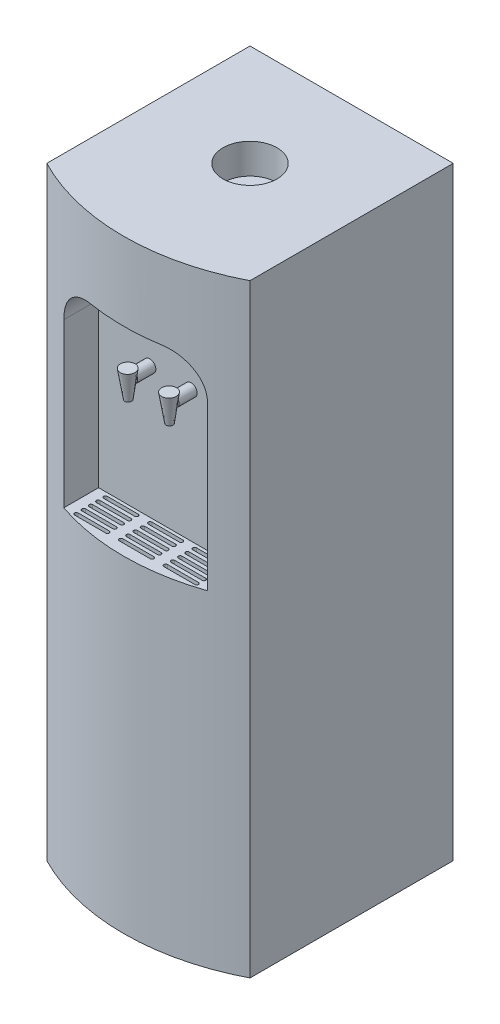
from build123d import *

# Parameters (mm, degrees)
BOSS_EXTRUDE1_DEPTH = 127
CUT_EXTRUDE1_DEPTH  = 88.9
CUT_EXTRUDE2_DEPTH  = 1.27
CUT_EXTRUDE3_DEPTH  = 6.35
SKETCH6_R           = 1.27
BOSS_EXTRUDE2_DEPTH = 3.81
SCALE1_SCALE        = 10
SCALE2_SCALE        = 0.8


with BuildPart() as part:
    # Sketch1 → Boss-Extrude1 (new body)
    with BuildSketch(Plane(origin=(0, 0, 0), x_dir=(1, 0, 0), z_dir=(0, 1, 0))):
        with BuildLine():
            Line((0, 0), (42.739614803, 0))
            Line((42.739614803, 0), (42.739614803, -42.739614803))
            ThreePointArc((42.739614803, -42.739614803), (21.369807402, -47.941054373), (0, -42.739614803))
            Line((0, -42.739614803), (0, 0))
        make_face()
    extrude(amount=BOSS_EXTRUDE1_DEPTH)

    # Sketch2 → Cut-Extrude1 (cut)
    with BuildSketch(Plane.XY.offset(127)):
        with BuildLine():
            Line((13.881687598, 110.608783011), (28.857927206, 110.608783011))
            ThreePointArc((28.857927206, 110.608783011), (34.246080878, 108.376936683), (36.477927206, 102.988783011))
            Line((36.477927206, 102.988783011), (36.477927206, 68.734309223))
            Line((36.477927206, 68.734309223), (6.261687598, 68.734309223))
            Line((6.261687598, 68.734309223), (6.261687598, 102.988783011))
            ThreePointArc((6.261687598, 102.988783011), (8.493533925, 108.376936683), (13.881687598, 110.608783011))
        make_face()
    extrude(amount=-CUT_EXTRUDE1_DEPTH, mode=Mode.SUBTRACT)

    # Sketch4 → Cut-Extrude2 (cut)
    with BuildSketch(Plane(origin=(0, 68.734309223, 0), x_dir=(1, 0, 0), z_dir=(0, 1, 0))):
        with BuildLine():
            Line((18.101107041, -45.607119247), (24.638507762, -45.607119247))
            ThreePointArc((24.638507762, -45.607119247), (25.019507762, -45.226119247), (24.638507762, -44.845119247))
            Line((24.638507762, -44.845119247), (18.101107041, -44.845119247))
            ThreePointArc((18.101107041, -44.845119247), (17.720107041, -45.226119247), (18.101107041, -45.607119247))
        make_face()
        with BuildLine():
            Line((8.722196959, -45.607119247), (15.25959768, -45.607119247))
            ThreePointArc((15.25959768, -45.607119247), (15.64059768, -45.226119247), (15.25959768, -44.845119247))
            Line((15.25959768, -44.845119247), (8.722196959, -44.845119247))
            ThreePointArc((8.722196959, -44.845119247), (8.341196959, -45.226119247), (8.722196959, -45.607119247))
        make_face()
        with BuildLine():
            Line((8.722196959, -42.559119247), (15.25959768, -42.559119247))
            ThreePointArc((15.25959768, -42.559119247), (15.64059768, -42.178119247), (15.25959768, -41.797119247))
            Line((15.25959768, -41.797119247), (8.722196959, -41.797119247))
            ThreePointArc((8.722196959, -41.797119247), (8.341196959, -42.178119247), (8.722196959, -42.559119247))
        make_face()
        with BuildLine():
            Line((8.722196959, -44.083119247), (15.25959768, -44.083119247))
            ThreePointArc((15.25959768, -44.083119247), (15.64059768, -43.702119247), (15.25959768, -43.321119247))
            Line((15.25959768, -43.321119247), (8.722196959, -43.321119247))
            ThreePointArc((8.722196959, -43.321119247), (8.341196959, -43.702119247), (8.722196959, -44.083119247))
        make_face()
        with BuildLine():
            Line((18.101107041, -44.083119247), (24.638507762, -44.083119247))
            ThreePointArc((24.638507762, -44.083119247), (25.019507762, -43.702119247), (24.638507762, -43.321119247))
            Line((24.638507762, -43.321119247), (18.101107041, -43.321119247))
            ThreePointArc((18.101107041, -43.321119247), (17.720107041, -43.702119247), (18.101107041, -44.083119247))
        make_face()
        with BuildLine():
            Line((18.101107041, -42.559119247), (24.638507762, -42.559119247))
            ThreePointArc((24.638507762, -42.559119247), (25.019507762, -42.178119247), (24.638507762, -41.797119247))
            Line((24.638507762, -41.797119247), (18.101107041, -41.797119247))
            ThreePointArc((18.101107041, -41.797119247), (17.720107041, -42.178119247), (18.101107041, -42.559119247))
        make_face()
        with BuildLine():
            Line((18.101107041, -41.035119247), (24.638507762, -41.035119247))
            ThreePointArc((24.638507762, -41.035119247), (25.019507762, -40.654119247), (24.638507762, -40.273119247))
            Line((24.638507762, -40.273119247), (18.101107041, -40.273119247))
            ThreePointArc((18.101107041, -40.273119247), (17.720107041, -40.654119247), (18.101107041, -41.035119247))
        make_face()
        with BuildLine():
            Line((18.101107041, -39.511119247), (24.638507762, -39.511119247))
            ThreePointArc((24.638507762, -39.511119247), (25.019507762, -39.130119247), (24.638507762, -38.749119247))
            Line((24.638507762, -38.749119247), (18.101107041, -38.749119247))
            ThreePointArc((18.101107041, -38.749119247), (17.720107041, -39.130119247), (18.101107041, -39.511119247))
        make_face()
        with BuildLine():
            Line((8.722196959, -41.035119247), (15.25959768, -41.035119247))
            ThreePointArc((15.25959768, -41.035119247), (15.64059768, -40.654119247), (15.25959768, -40.273119247))
            Line((15.25959768, -40.273119247), (8.722196959, -40.273119247))
            ThreePointArc((8.722196959, -40.273119247), (8.341196959, -40.654119247), (8.722196959, -41.035119247))
        make_face()
        with BuildLine():
            Line((8.722196959, -39.511119247), (15.25959768, -39.511119247))
            ThreePointArc((15.25959768, -39.511119247), (15.64059768, -39.130119247), (15.25959768, -38.749119247))
            Line((15.25959768, -38.749119247), (8.722196959, -38.749119247))
            ThreePointArc((8.722196959, -38.749119247), (8.341196959, -39.130119247), (8.722196959, -39.511119247))
        make_face()
        with BuildLine():
            Line((27.480017123, -44.083119247), (34.017417844, -44.083119247))
            ThreePointArc((34.017417844, -44.083119247), (34.398417844, -43.702119247), (34.017417844, -43.321119247))
            Line((34.017417844, -43.321119247), (27.480017123, -43.321119247))
            ThreePointArc((27.480017123, -43.321119247), (27.099017123, -43.702119247), (27.480017123, -44.083119247))
        make_face()
        with BuildLine():
            Line((27.480017123, -42.559119247), (34.017417844, -42.559119247))
            ThreePointArc((34.017417844, -42.559119247), (34.398417844, -42.178119247), (34.017417844, -41.797119247))
            Line((34.017417844, -41.797119247), (27.480017123, -41.797119247))
            ThreePointArc((27.480017123, -41.797119247), (27.099017123, -42.178119247), (27.480017123, -42.559119247))
        make_face()
        with BuildLine():
            Line((27.480017123, -41.035119247), (34.017417844, -41.035119247))
            ThreePointArc((34.017417844, -41.035119247), (34.398417844, -40.654119247), (34.017417844, -40.273119247))
            Line((34.017417844, -40.273119247), (27.480017123, -40.273119247))
            ThreePointArc((27.480017123, -40.273119247), (27.099017123, -40.654119247), (27.480017123, -41.035119247))
        make_face()
        with BuildLine():
            Line((27.480017123, -39.511119247), (34.017417844, -39.511119247))
            ThreePointArc((34.017417844, -39.511119247), (34.398417844, -39.130119247), (34.017417844, -38.749119247))
            Line((34.017417844, -38.749119247), (27.480017123, -38.749119247))
            ThreePointArc((27.480017123, -38.749119247), (27.099017123, -39.130119247), (27.480017123, -39.511119247))
        make_face()
        with BuildLine():
            ThreePointArc((27.480017123, -44.845119247), (27.099017123, -45.226119247), (27.480017123, -45.607119247))
            Line((27.480017123, -45.607119247), (34.017417844, -45.607119247))
            ThreePointArc((34.017417844, -45.607119247), (34.398417844, -45.226119247), (34.017417844, -44.845119247))
            Line((34.017417844, -44.845119247), (27.480017123, -44.845119247))
        make_face()
    extrude(amount=-CUT_EXTRUDE2_DEPTH, mode=Mode.SUBTRACT)

    # Sketch5 → Cut-Extrude3 (cut)
    with BuildSketch(Plane(origin=(0, 127, 0), x_dir=(1, 0, 0), z_dir=(0, 1, 0))):
        with BuildLine():
            ThreePointArc((27.058825704, -21.369807402), (21.369807402, -15.680789099), (15.680789099, -21.369807402))
            Line((15.680789099, -21.369807402), (27.058825704, -21.369807402))
        make_face()
        with BuildLine():
            Line((27.058825704, -21.369807402), (15.680789099, -21.369807402))
            ThreePointArc((15.680789099, -21.369807402), (21.369807402, -27.058825704), (27.058825704, -21.369807402))
        make_face()
    extrude(amount=-CUT_EXTRUDE3_DEPTH, mode=Mode.SUBTRACT)

    # Sketch6 → Boss-Extrude2 (add)
    with BuildSketch(Plane.XY.offset(38.1)):
        with Locations(Location((17.026937254, 96.316061715, 0), (0, 0, 180))):
            Circle(SKETCH6_R)
        with Locations(Location((25.712677549, 96.316061715, 0), (0, 0, 180))):
            Circle(SKETCH6_R)
    extrude(amount=BOSS_EXTRUDE2_DEPTH)

    # Sketch8 → Revolve1 (revolve)
    with BuildSketch(Plane.YZ.offset(17.026937254), mode=Mode.PRIVATE) as revolve1_sk:
        Polygon((92.462776609, 42.625909045), (92.462776609, 43.341818089), (98.173073883, 44.293534302), (98.173073883, 42.739614803), align=None)
    revolve1 = revolve(revolve1_sk.sketch.rotate(Axis((17.026937254, 92.462776609, 42.625909045), (0, 0.9998018069764348, 0.01990845967561906)), 180), axis=Axis((17.026937254, 92.462776609, 42.625909045), (0, 0.9998018069764348, 0.01990845967561906)))

    # Mirror1: Revolve1 across plane
    add(revolve1.mirror(Plane.ZY.offset(-21.369807402)))


with BuildPart() as part_1:
    # Scale1: scaled about (21.369807188, 62.136257344, 22.239140039)
    add(part.part.scale(SCALE1_SCALE).moved(Location((-192.328264692, -559.226316096, -200.152260351))))


with BuildPart() as part_2:
    # Scale2: scaled about (21.369807187, 62.136257344, 22.239140034)
    add(part_1.part.scale(SCALE2_SCALE).moved(Location((4.273961437, 12.427251469, 4.447828007))))


solid = part_2.part
